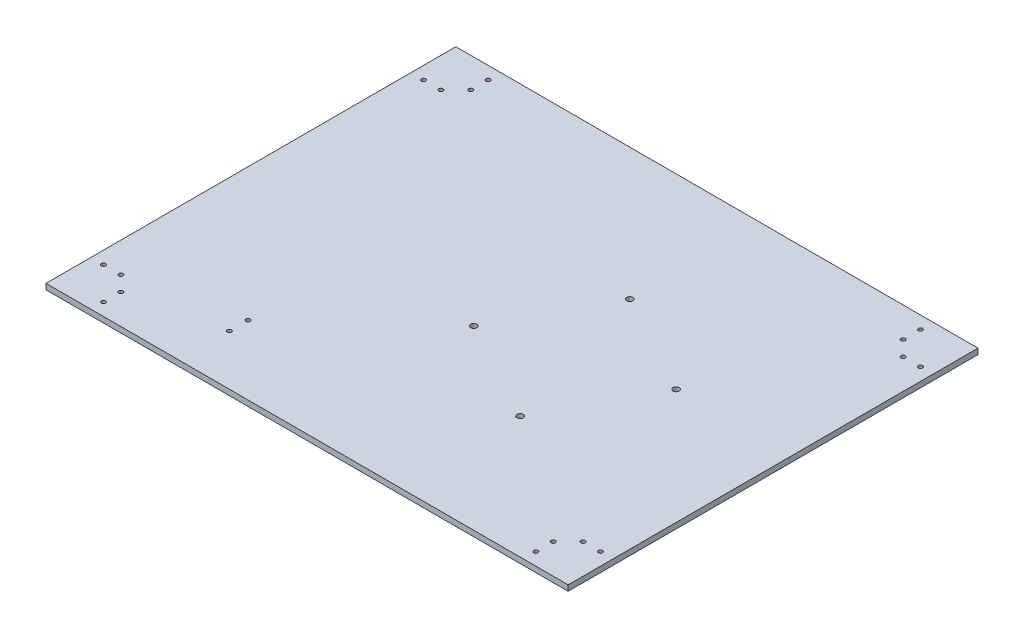
from build123d import *

# Parameters (mm, degrees)
SCHIZZO1_W                   = 558
SCHIZZO1_H                   = 438
ESTRUSIONE_ESTRUSIONE1_DEPTH = 6
SCHIZZO2_R                   = 2.25
TAGLIO_ESTRUSIONE1_DEPTH     = 10
SCHIZZO4_R                   = 3.3
TAGLIO_ESTRUSIONE2_DEPTH     = 10
SCHIZZO5_R                   = 2.25
TAGLIO_ESTRUSIONE3_DEPTH     = 10


with BuildPart() as part:
    # Schizzo1 → Estrusione-Estrusione1 (new body)
    with BuildSketch(Plane(origin=(0, 0, 0), x_dir=(1, 0, 0), z_dir=(0, 1, 0))):
        Rectangle(SCHIZZO1_W, SCHIZZO1_H)
    extrude(amount=ESTRUSIONE_ESTRUSIONE1_DEPTH)

    # Schizzo2 → Taglio-Estrusione1 (cut)
    with BuildSketch(Plane(origin=(0, 6, 0), x_dir=(1, 0, 0), z_dir=(0, 1, 0))):
        with Locations(Location((-231, 205.5, 0), (0, 0, 270))):
            Circle(SCHIZZO2_R)
        with Locations(Location((-231, 187, 0), (0, 0, 270))):
            Circle(SCHIZZO2_R)
        with Locations(Location((-247, 171, 0), (0, 0, 270))):
            Circle(SCHIZZO2_R)
        with Locations(Location((-265.5, 171, 0), (0, 0, 270))):
            Circle(SCHIZZO2_R)
        with Locations(Location((231, 205.5, 0), (0, 0, 270))):
            Circle(SCHIZZO2_R)
        with Locations(Location((231, 187, 0), (0, 0, 270))):
            Circle(SCHIZZO2_R)
        with Locations(Location((247, 171, 0), (0, 0, 270))):
            Circle(SCHIZZO2_R)
        with Locations(Location((265.5, 171, 0), (0, 0, 270))):
            Circle(SCHIZZO2_R)
        with Locations(Location((265.5, -171, 0), (0, 0, 270))):
            Circle(SCHIZZO2_R)
        with Locations(Location((247, -171, 0), (0, 0, 270))):
            Circle(SCHIZZO2_R)
        with Locations(Location((231, -187, 0), (0, 0, 270))):
            Circle(SCHIZZO2_R)
        with Locations(Location((231, -205.5, 0), (0, 0, 270))):
            Circle(SCHIZZO2_R)
        with Locations(Location((-231, -205.5, 0), (0, 0, 270))):
            Circle(SCHIZZO2_R)
        with Locations(Location((-231, -187, 0), (0, 0, 270))):
            Circle(SCHIZZO2_R)
        with Locations(Location((-247, -171, 0), (0, 0, 270))):
            Circle(SCHIZZO2_R)
        with Locations(Location((-265.5, -171, 0), (0, 0, 270))):
            Circle(SCHIZZO2_R)
    extrude(amount=-TAGLIO_ESTRUSIONE1_DEPTH, mode=Mode.SUBTRACT)

    # Schizzo4 → Taglio-Estrusione2 (cut)
    with BuildSketch(Plane(origin=(0, 6, 0), x_dir=(1, 0, 0), z_dir=(0, 1, 0))):
        with Locations(Location((-11.04713937, -29.950902322, 0), (0, 0, 270))):
            Circle(SCHIZZO4_R)
        with Locations(Location((97.170402481, -88.545989873, 0), (0, 0, 270))):
            Circle(SCHIZZO4_R)
        with Locations(Location((155.765489817, 19.671552094, 0), (0, 0, 270))):
            Circle(SCHIZZO4_R)
        with Locations(Location((47.547947967, 78.266639645, 0), (0, 0, 270))):
            Circle(SCHIZZO4_R)
    extrude(amount=-TAGLIO_ESTRUSIONE2_DEPTH, mode=Mode.SUBTRACT)

    # Schizzo5 → Taglio-Estrusione3 (cut)
    with BuildSketch(Plane.XZ):
        with Locations(Location((-136.921607377, 165.135242981, 0), (0, 0, 270))):
            Circle(SCHIZZO5_R)
        with Locations(Location((-136.921607377, 145.135242981, 0), (0, 0, 270))):
            Circle(SCHIZZO5_R)
    extrude(amount=-TAGLIO_ESTRUSIONE3_DEPTH, mode=Mode.SUBTRACT)


solid = part.part
